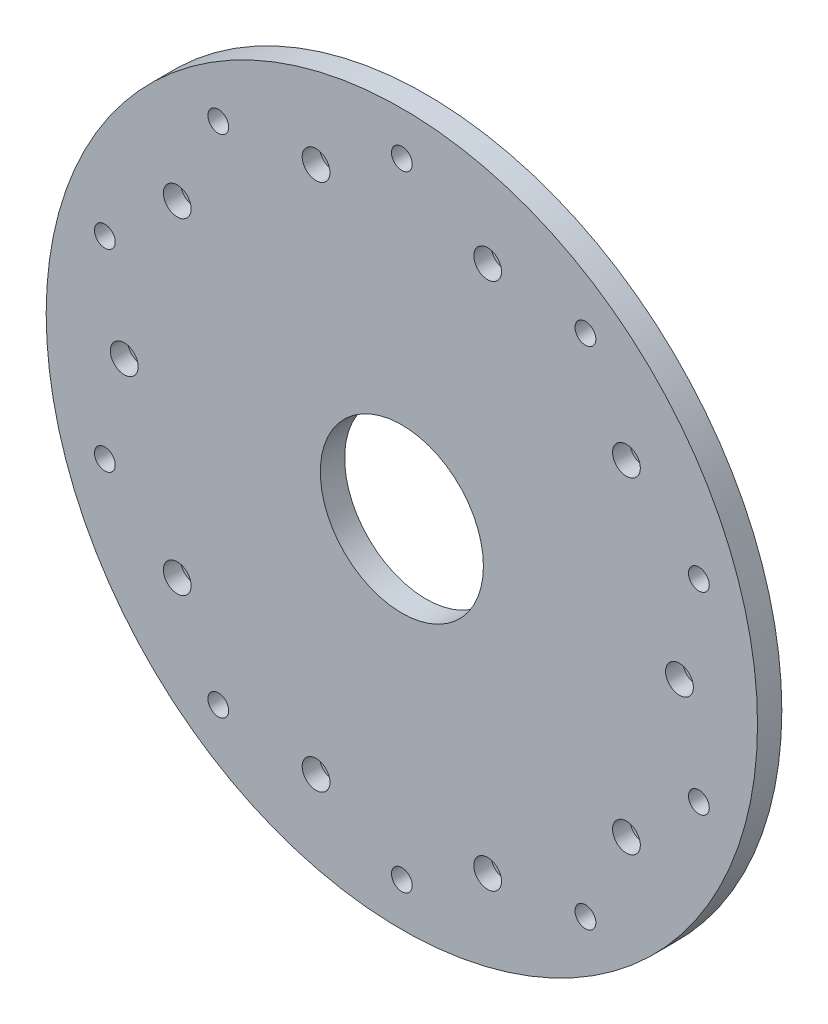
from build123d import *

# Parameters (mm, degrees)
SKETCH1_R           = 102.5
SKETCH1_R_2         = 23.5
BOSS_EXTRUDE1_DEPTH = 7
SKETCH2_R           = 3
CUT_EXTRUDE1_DEPTH  = 146.125807491
SKETCH3_R           = 4
CUT_EXTRUDE2_DEPTH  = 5
CIRPATTERN1_COUNT   = 10


with BuildPart() as part:
    # Sketch1 → Boss-Extrude1 (new body)
    with BuildSketch(Plane.XY):
        Circle(SKETCH1_R)
        Circle(SKETCH1_R_2, mode=Mode.SUBTRACT)
    extrude(amount=BOSS_EXTRUDE1_DEPTH)

    # Sketch2 → Cut-Extrude1 (cut, through all)
    with BuildSketch(Plane.XY.offset(7)):
        with Locations((0, 90)):
            Circle(SKETCH2_R)
        with Locations((52.900672706, 72.811529494)):
            Circle(SKETCH2_R)
        with Locations((85.595086467, 27.811529494)):
            Circle(SKETCH2_R)
        with Locations((85.595086467, -27.811529494)):
            Circle(SKETCH2_R)
        with Locations((52.900672706, -72.811529494)):
            Circle(SKETCH2_R)
        with Locations((0, -90)):
            Circle(SKETCH2_R)
        with Locations((-52.900672706, -72.811529494)):
            Circle(SKETCH2_R)
        with Locations((-85.595086467, -27.811529494)):
            Circle(SKETCH2_R)
        with Locations((-85.595086467, 27.811529494)):
            Circle(SKETCH2_R)
        with Locations((-52.900672706, 72.811529494)):
            Circle(SKETCH2_R)
    extrude(amount=-CUT_EXTRUDE1_DEPTH, mode=Mode.SUBTRACT)

    # Sketch3 → Cut-Extrude2 (cut)
    with BuildSketch(Plane.XY.offset(7)):
        with Locations((24.72135955, 76.084521304)):
            Circle(SKETCH3_R)
    cut_extrude2 = extrude(amount=-CUT_EXTRUDE2_DEPTH, mode=Mode.SUBTRACT)

    # CirPattern1: Cut-Extrude2 ×10 about axis
    cirpattern1_axis = Axis((0, 0, 0), (0, 0, 1))
    for i in range(1, CIRPATTERN1_COUNT):
        add(cut_extrude2.rotate(cirpattern1_axis, i * 360 / CIRPATTERN1_COUNT), mode=Mode.SUBTRACT)


solid = part.part
